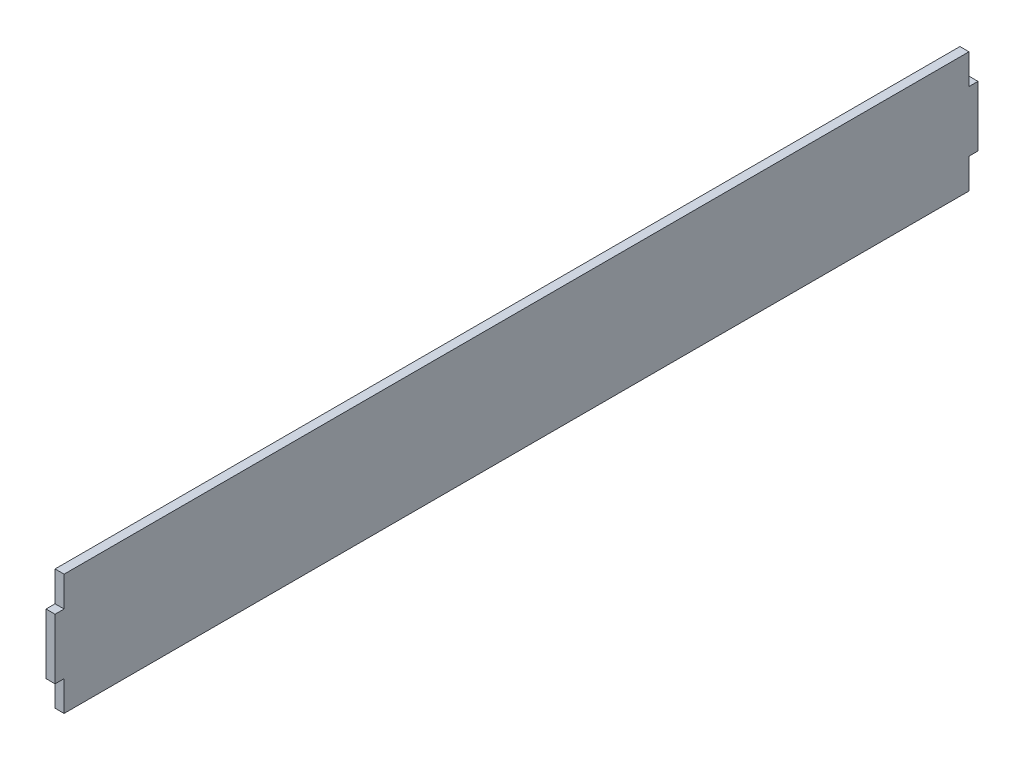
from build123d import *

# Parameters (mm, degrees)
BOSS_EXTRUDE2_DEPTH = 3


with BuildPart() as part:
    # Sketch1 → Boss-Extrude2 (new body)
    with BuildSketch(Plane(origin=(0, 0, 0), x_dir=(0, 0, -1), z_dir=(1, 0, 0))):
        Polygon((-176.195672359, 58.939179808), (123.804327641, 58.939179808), (123.804327641, 48.939179808), (126.804327641, 48.939179808), (126.804327641, 28.939179808), (123.804327641, 28.939179808), (123.804327641, 18.939179808), (-176.195672359, 18.939179808), (-176.195672359, 28.939179808), (-179.195672359, 28.939179808), (-179.195672359, 48.939179808), (-176.195672359, 48.939179808), align=None)
    extrude(amount=BOSS_EXTRUDE2_DEPTH)


solid = part.part
